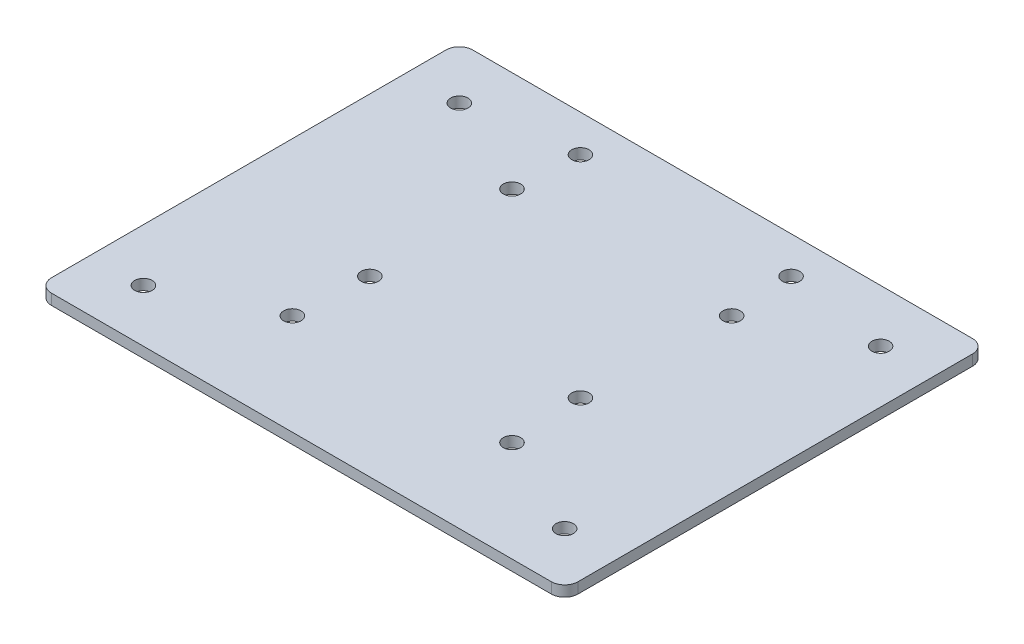
from build123d import *

# Parameters (mm, degrees)
SKETCH1_W           = 100
SKETCH1_H           = 80
SKETCH1_R           = 1.651
BOSS_EXTRUDE1_DEPTH = 2.032
FILLET1_R           = 2.54
FILLET2_R           = 2.54


with BuildPart() as part:
    # Sketch1 → Boss-Extrude1 (new body)
    with BuildSketch(Plane(origin=(0, 0, 0), x_dir=(1, 0, 0), z_dir=(0, 1, 0))):
        with Locations((3.469387755, -11.530612245)):
            Rectangle(SKETCH1_W, SKETCH1_H)
        with Locations(Location((-36.530612245, 18.469387755, 0), (0, 0, 270))):
            Circle(SKETCH1_R, mode=Mode.SUBTRACT)
        with Locations(Location((-36.530612245, -41.530612245, 0), (0, 0, 270))):
            Circle(SKETCH1_R, mode=Mode.SUBTRACT)
        with Locations(Location((-16.530612245, 21.469387755, 0), (0, 0, 270))):
            Circle(SKETCH1_R, mode=Mode.SUBTRACT)
        with Locations(Location((23.469387755, 21.469387755, 0), (0, 0, 270))):
            Circle(SKETCH1_R, mode=Mode.SUBTRACT)
        with Locations(Location((-16.530612245, -18.530612245, 0), (0, 0, 270))):
            Circle(SKETCH1_R, mode=Mode.SUBTRACT)
        with Locations(Location((23.469387755, -18.530612245, 0), (0, 0, 270))):
            Circle(SKETCH1_R, mode=Mode.SUBTRACT)
        with Locations(Location((-17.39026229, 9.3290378, 0), (0, 0, 270))):
            Circle(SKETCH1_R, mode=Mode.SUBTRACT)
        with Locations(Location((24.3290378, 9.3290378, 0), (0, 0, 270))):
            Circle(SKETCH1_R, mode=Mode.SUBTRACT)
        with Locations(Location((43.469387755, -41.530612245, 0), (0, 0, 90))):
            Circle(SKETCH1_R, mode=Mode.SUBTRACT)
        with Locations(Location((43.469387755, 18.469387755, 0), (0, 0, 90))):
            Circle(SKETCH1_R, mode=Mode.SUBTRACT)
        with Locations(Location((-17.39026229, -32.39026229, 0), (0, 0, 270))):
            Circle(SKETCH1_R, mode=Mode.SUBTRACT)
        with Locations(Location((24.3290378, -32.39026229, 0), (0, 0, 270))):
            Circle(SKETCH1_R, mode=Mode.SUBTRACT)
    extrude(amount=BOSS_EXTRUDE1_DEPTH)

    # Fillet1
    fillet1_edges = [part.edges().sort_by_distance(p)[0] for p in [
        (-46.530612245, 1.016, 51.530612245),
    ]]
    fillet(fillet1_edges, radius=FILLET1_R)

    # Fillet2
    fillet2_edges = [part.edges().sort_by_distance(p)[0] for p in [
        (-46.530612245, 1.016, -28.469387755),
        (53.469387755, 1.016, -28.469387755),
        (53.469387755, 1.016, 51.530612245),
    ]]
    fillet(fillet2_edges, radius=FILLET2_R)


solid = part.part
